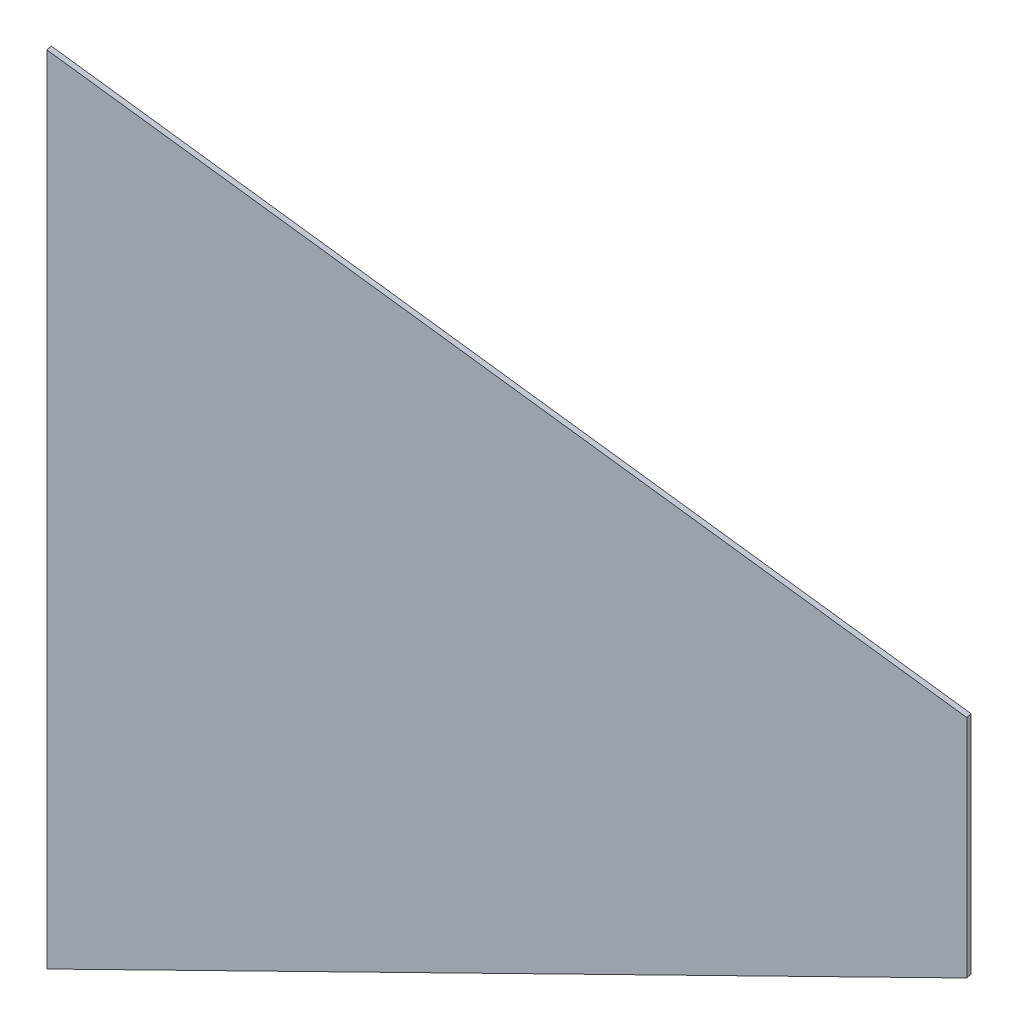
from build123d import *

# Parameters (mm, degrees)
BOSS_EXTRUDE1_DEPTH     = 3.175
CUT_EXTRUDE1_DEPTH      = 582.461637412
CUT_EXTRUDE1_DEPTH_BACK = 582.461637412
SKETCH2_W               = 101.6
SKETCH2_H               = 126.99990409


with BuildPart() as part:
    # Sketch1 → Boss-Extrude1 (new body)
    with BuildSketch(Plane(origin=(161.017557723, 0, 726.303266861), x_dir=(0, 1, 0), z_dir=(0.2164396139381031, 0, 0.9762960071199334))):
        Polygon((-224.098656226, 535.871175677), (-25.92705, 0), (25.92705, 0), (224.098656226, 535.871175677), align=None)
    extrude(amount=-BOSS_EXTRUDE1_DEPTH)

    # Sketch2 → Cut-Extrude1 (cut, two sides: drawn at the far end of the back side and taken through both)
    with BuildSketch(Plane(origin=(161.017557723, 0, 726.303266861), x_dir=(0.9762960071199334, 0, -0.21643961393810304), z_dir=(0.21643961393810301, 0, 0.9762960071199333)).offset(-CUT_EXTRUDE1_DEPTH_BACK)):
        with Locations((-50.8, 0)):
            Rectangle(SKETCH2_W, SKETCH2_H)
    extrude(amount=CUT_EXTRUDE1_DEPTH + CUT_EXTRUDE1_DEPTH_BACK, mode=Mode.SUBTRACT)


solid = part.part
